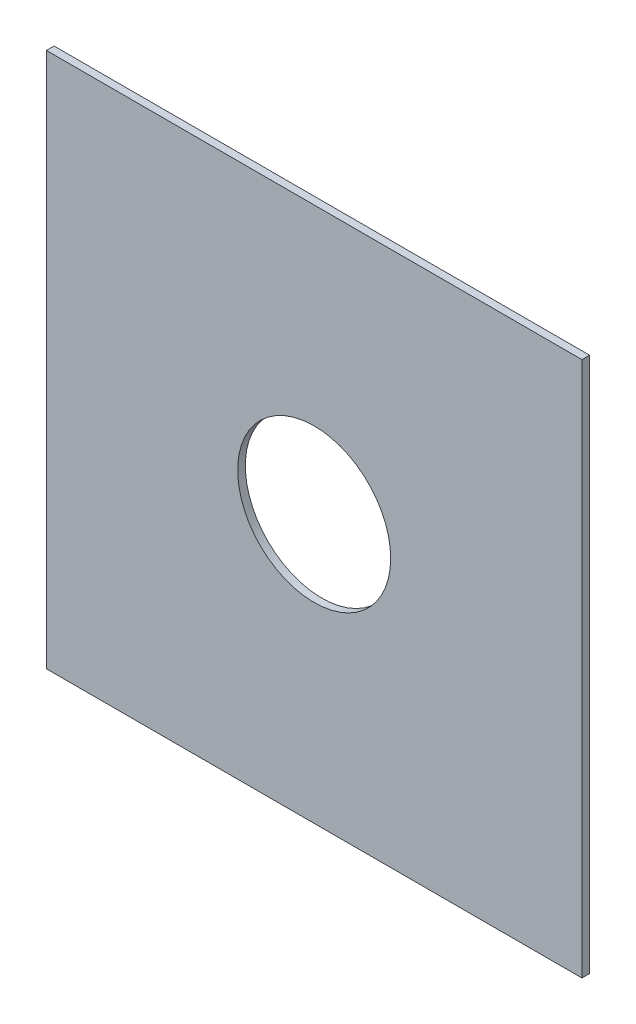
from build123d import *

# Parameters (mm, degrees)
SKETCH_1_W      = 700
SKETCH_1_H      = 700
SKETCH_1_R      = 100
EXTRUDE_1_DEPTH = 10


with BuildPart() as part:
    # 草图1 → 凸台-拉伸1 (new body)
    with BuildSketch(Plane.XY):
        with Locations((300.102689699, -319.158948909)):
            Rectangle(SKETCH_1_W, SKETCH_1_H)
        with Locations((300.102689699, -319.158948909)):
            Circle(SKETCH_1_R, mode=Mode.SUBTRACT)
    extrude(amount=EXTRUDE_1_DEPTH)


solid = part.part
